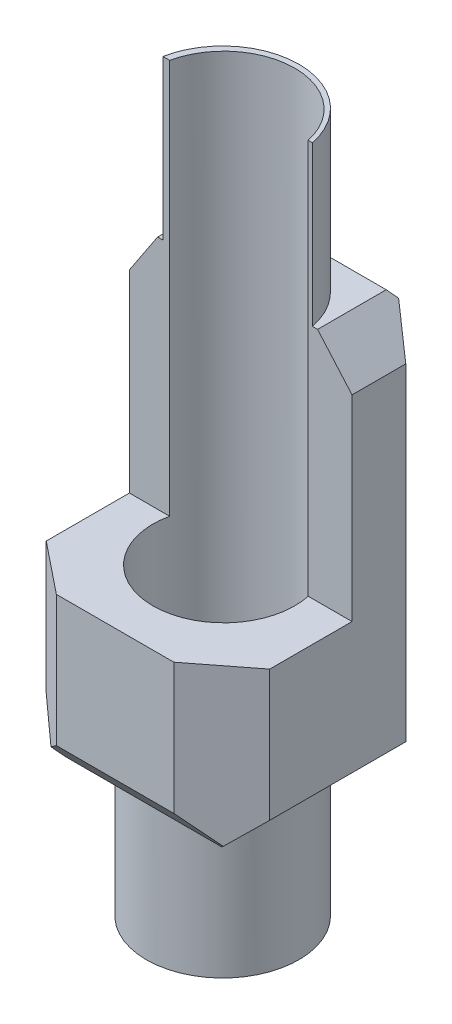
from build123d import *

# Parameters (mm, degrees)
SKETCH1_W           = 100
SKETCH1_H           = 100
BOSS_EXTRUDE1_DEPTH = 180
SKETCH2_R           = 34.257790197
BOSS_EXTRUDE2_DEPTH = 350
SKETCH3_W           = 152.006357392
SKETCH3_H           = 282.452416457
CUT_EXTRUDE2_DEPTH  = 400
CUT_EXTRUDE3_DEPTH  = 400
CUT_EXTRUDE4_DEPTH  = 400
CUT_EXTRUDE5_DEPTH  = 400
SKETCH7_W           = 160.159381639
SKETCH7_H           = 147.362276113
CUT_EXTRUDE6_DEPTH  = 400
SKETCH8_W           = 147.310744502
SKETCH8_H           = 162.038906966
CUT_EXTRUDE7_DEPTH  = 400
SKETCH9_R           = 31.847293423
CUT_EXTRUDE8_DEPTH  = 400
SKETCH10_W          = 140.220962397
SKETCH10_H          = 212.033531124
CUT_EXTRUDE9_DEPTH  = 400


with BuildPart() as part:
    # Sketch1 → Boss-Extrude1 (new body)
    with BuildSketch(Plane(origin=(0, 0, 0), x_dir=(1, 0, 0), z_dir=(0, 1, 0))):
        with Locations((-50, 50)):
            Rectangle(SKETCH1_W, SKETCH1_H)
    extrude(amount=BOSS_EXTRUDE1_DEPTH)

    # Sketch2 → Boss-Extrude2 (add, symmetric)
    with BuildSketch(Plane(origin=(0, 180, 0), x_dir=(1, 0, 0), z_dir=(0, 1, 0))):
        with Locations(Location((-51.377291833, 49.076536384, 0), (0, 0, 270))):
            Circle(SKETCH2_R)
    extrude(amount=BOSS_EXTRUDE2_DEPTH, both=True)

    # Sketch3 → Cut-Extrude2 (cut)
    with BuildSketch(Plane(origin=(0, 0, 0), x_dir=(0, 0, -1), z_dir=(1, 0, 0))):
        with Locations((57.419900112, 502.274302507)):
            Rectangle(SKETCH3_W, SKETCH3_H)
    extrude(amount=-CUT_EXTRUDE2_DEPTH, mode=Mode.SUBTRACT)

    # Sketch4 → Cut-Extrude3 (cut)
    with BuildSketch(Plane(origin=(0, 0, 0), x_dir=(0, 0, -1), z_dir=(1, 0, 0))):
        Polygon((12.981970869, 0), (-8.994244796, 25.828096003), (-18.564506014, -15.259465835), align=None)
        Polygon((85.072517936, -1.448103984), (109.237639161, 19.113145112), (115.920034239, -3.267382694), align=None)
        Polygon((12.981970869, 180), (-8.994244796, 148.537596011), (-15.418178585, 193.219274892), align=None)
        Polygon((85.072517936, 181.854312784), (103.841225373, 159.795920888), (106.132549481, 198.647393934), align=None)
    extrude(amount=-CUT_EXTRUDE3_DEPTH, mode=Mode.SUBTRACT)

    # Sketch5 → Cut-Extrude4 (cut)
    with BuildSketch(Plane.XY):
        Polygon((-85.623287335, 0), (-106.370377984, 21.426392531), (-122.288861874, 3.209259887), (-93.526345261, -19.884701759), align=None)
        Polygon((-15.694988751, 0), (0, 15.257385304), (12.122677088, 15.257385304), (10.563067769, -19.884701759), align=None)
        Polygon((-87.166490339, 180.248071029), (-106.370377984, 151.29108453), (-117.705469457, 200.501115102), align=None)
        Polygon((-15.694988751, 180.248071029), (7.833767065, 153.279557508), (0, 193.941208308), align=None)
    extrude(amount=-CUT_EXTRUDE4_DEPTH, mode=Mode.SUBTRACT)

    # Sketch6 → Cut-Extrude5 (cut)
    with BuildSketch(Plane(origin=(0, 180, 0), x_dir=(1, 0, 0), z_dir=(0, 1, 0))):
        Polygon((-112.386997555, 28.400400964), (-64.261264503, -10.212759359), (-84.406366528, -15.51192827), (-124.649689542, -15.51192827), align=None)
        Polygon((-97.065537028, 135.861756084), (-119.37552445, 77.792688888), (-118.043343626, 64.347606737), (-66.428694172, 110.575168787), align=None)
        Polygon((-24.69640689, -21.815840769), (11.092108798, -8.97361337), (17.428316417, 32.393768119), (-38.531576846, -11.139157378), align=None)
        Polygon((-17.445484601, 140.804394854), (35.417473102, 107.262520599), (9.305452855, 72.996438725), (-31.724385352, 103.625272537), align=None)
    extrude(amount=-CUT_EXTRUDE5_DEPTH, mode=Mode.SUBTRACT)

    # Sketch7 → Cut-Extrude6 (cut)
    with BuildSketch(Plane.XY):
        with Locations((-66.123258915, -136.36252694)):
            Rectangle(SKETCH7_W, SKETCH7_H)
    extrude(amount=-CUT_EXTRUDE6_DEPTH, mode=Mode.SUBTRACT)

    # Sketch8 → Cut-Extrude7 (cut)
    with BuildSketch(Plane.XY):
        with Locations((-53.541153336, 332.448287589)):
            Rectangle(SKETCH8_W, SKETCH8_H)
    extrude(amount=-CUT_EXTRUDE7_DEPTH, mode=Mode.SUBTRACT)

    # Sketch9 → Cut-Extrude8 (cut)
    with BuildSketch(Plane(origin=(0, 251.428834106, 0), x_dir=(1, 0, 0), z_dir=(0, 1, 0))):
        with Locations(Location((-50.808993157, 49.032036374, 0), (0, 0, 270))):
            Circle(SKETCH9_R)
    extrude(amount=-CUT_EXTRUDE8_DEPTH, mode=Mode.SUBTRACT)

    # Sketch10 → Cut-Extrude9 (cut)
    with BuildSketch(Plane.ZY.offset(100)):
        with Locations((14.299084536, 180.100625535)):
            Rectangle(SKETCH10_W, SKETCH10_H)
    extrude(amount=-CUT_EXTRUDE9_DEPTH, mode=Mode.SUBTRACT)


solid = part.part
